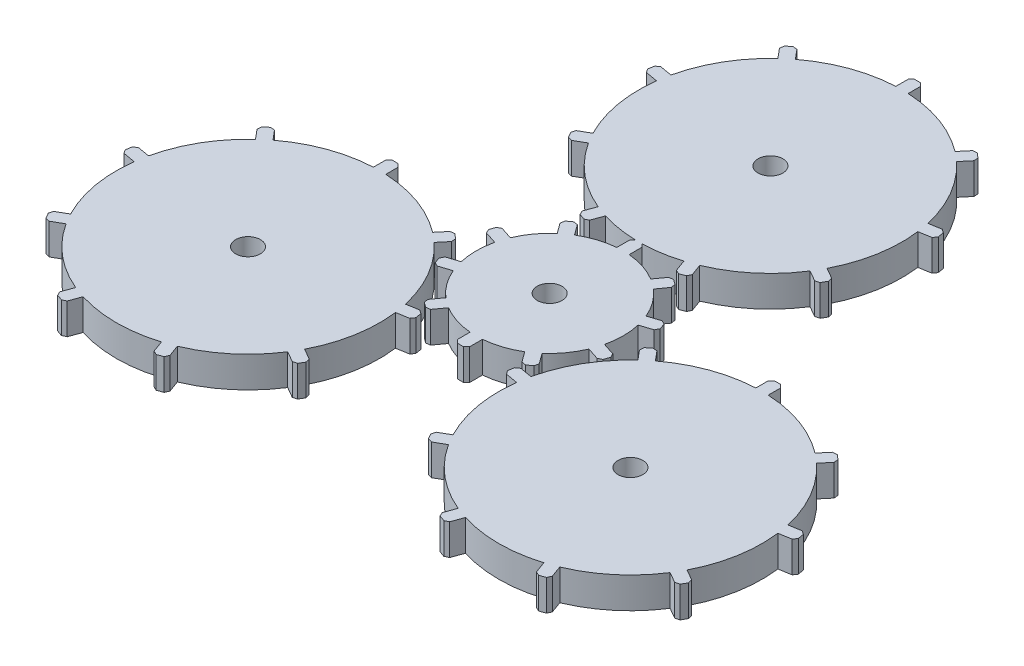
from build123d import *

# Parameters (mm, degrees)
SKETCH_1_R        = 4
EXTRUDE_1_DEPTH   = 10
EXTRUDE_1_2_DEPTH = 10
EXTRUDE_1_3_DEPTH = 10


with BuildPart() as part:
    # 草圖1 → 填料-伸長1 (new body)
    with BuildSketch(Plane(origin=(0, 0, 0), x_dir=(1, 0, 0), z_dir=(0, 1, 0))):
        with BuildLine():
            Line((1, 118.707876059), (-1, 118.707876059))
            Line((-1, 118.707876059), (-2, 117.707876059))
            Line((-2, 117.707876059), (-2, 113.702915094))
            ThreePointArc((-2, 113.702915094), (-14.535856091, 111.186936383), (-25.756118931, 105.056394922))
            Line((-25.756118931, 105.056394922), (-28.330458217, 108.124373013))
            Line((-28.330458217, 108.124373013), (-29.739290269, 108.247629847))
            Line((-29.739290269, 108.247629847), (-31.271379156, 106.962054627))
            Line((-31.271379156, 106.962054627), (-31.394635989, 105.553222574))
            Line((-31.394635989, 105.553222574), (-28.820296704, 102.485244483))
            ThreePointArc((-28.820296704, 102.485244483), (-36.806079661, 92.5), (-41.460663567, 80.591486849))
            Line((-41.460663567, 80.591486849), (-45.404780176, 81.286941022))
            Line((-45.404780176, 81.286941022), (-46.563236106, 80.475781447))
            Line((-46.563236106, 80.475781447), (-46.910532462, 78.506165941))
            Line((-46.910532462, 78.506165941), (-46.099372886, 77.34771001))
            Line((-46.099372886, 77.34771001), (-42.155256278, 76.652255837))
            ThreePointArc((-42.155256278, 76.652255837), (-41.854329503, 63.869952449), (-37.765302936, 51.75559326))
            Line((-37.765302936, 51.75559326), (-41.233700873, 49.753112778))
            Line((-41.233700873, 49.753112778), (-41.599726276, 48.387087374))
            Line((-41.599726276, 48.387087374), (-40.599726276, 46.655036567))
            Line((-40.599726276, 46.655036567), (-39.233700873, 46.289011163))
            Line((-39.233700873, 46.289011163), (-35.765302936, 48.291491645))
            ThreePointArc((-35.765302936, 48.291491645), (-27.318473412, 38.693111167), (-16.399137347, 32.041349242))
            Line((-16.399137347, 32.041349242), (-17.76891467, 28.277916977))
            Line((-17.76891467, 28.277916977), (-17.171242192, 26.996204213))
            Line((-17.171242192, 26.996204213), (-15.291856951, 26.312163926))
            Line((-15.291856951, 26.312163926), (-14.010144187, 26.909836404))
            Line((-14.010144187, 26.909836404), (-12.640366864, 30.673268668))
            ThreePointArc((-12.640366864, 30.673268668), (-6.903848021, 29.314491389), (-1.034492743, 28.762592162))
            Line((-1.034492743, 28.762592162), (-2, 27.797084906))
            Line((-2, 27.797084906), (-2, 23.665639649))
            ThreePointArc((-2, 23.665639649), (-7.339153616, 22.587592262), (-12.292279983, 20.321475163))
            Line((-12.292279983, 20.321475163), (-14.720682576, 23.663884587))
            Line((-14.720682576, 23.663884587), (-16.117484822, 23.885116329))
            Line((-16.117484822, 23.885116329), (-17.735518811, 22.709545825))
            Line((-17.735518811, 22.709545825), (-17.956750553, 21.312743578))
            Line((-17.956750553, 21.312743578), (-15.528347961, 17.970334154))
            ThreePointArc((-15.528347961, 17.970334154), (-19.214153616, 13.959899742), (-21.889326812, 9.215197867))
            Line((-21.889326812, 9.215197867), (-25.818564745, 10.491884663))
            Line((-25.818564745, 10.491884663), (-27.078638256, 9.849845141))
            Line((-27.078638256, 9.849845141), (-27.696672244, 7.947732108))
            Line((-27.696672244, 7.947732108), (-27.054632722, 6.687658597))
            Line((-27.054632722, 6.687658597), (-23.125394789, 5.410971802))
            ThreePointArc((-23.125394789, 5.410971802), (-23.75, 0), (-23.125394789, -5.410971802))
            Line((-23.125394789, -5.410971802), (-27.054632722, -6.687658597))
            Line((-27.054632722, -6.687658597), (-27.696672244, -7.947732108))
            Line((-27.696672244, -7.947732108), (-27.078638256, -9.849845141))
            Line((-27.078638256, -9.849845141), (-25.818564745, -10.491884663))
            Line((-25.818564745, -10.491884663), (-21.889326812, -9.215197867))
            ThreePointArc((-21.889326812, -9.215197867), (-19.214153616, -13.959899742), (-15.528347961, -17.970334154))
            Line((-15.528347961, -17.970334154), (-17.956750553, -21.312743578))
            Line((-17.956750553, -21.312743578), (-17.735518811, -22.709545825))
            Line((-17.735518811, -22.709545825), (-16.117484822, -23.885116329))
            Line((-16.117484822, -23.885116329), (-14.720682576, -23.663884587))
            Line((-14.720682576, -23.663884587), (-12.292279983, -20.321475163))
            ThreePointArc((-12.292279983, -20.321475163), (-7.339153616, -22.587592262), (-2, -23.665639649))
            Line((-2, -23.665639649), (-2, -27.797084906))
            Line((-2, -27.797084906), (-1, -28.797084906))
            Line((-1, -28.797084906), (1, -28.797084906))
            Line((1, -28.797084906), (2, -27.797084906))
            Line((2, -27.797084906), (2, -23.665639649))
            ThreePointArc((2, -23.665639649), (7.339153616, -22.587592262), (12.292279983, -20.321475163))
            Line((12.292279983, -20.321475163), (14.720682576, -23.663884587))
            Line((14.720682576, -23.663884587), (16.117484822, -23.885116329))
            Line((16.117484822, -23.885116329), (17.735518811, -22.709545825))
            Line((17.735518811, -22.709545825), (17.956750553, -21.312743578))
            Line((17.956750553, -21.312743578), (15.528347961, -17.970334154))
            ThreePointArc((15.528347961, -17.970334154), (19.214153616, -13.959899742), (21.889326812, -9.215197867))
            Line((21.889326812, -9.215197867), (25.818564745, -10.491884663))
            Line((25.818564745, -10.491884663), (27.078638256, -9.849845141))
            Line((27.078638256, -9.849845141), (27.696672244, -7.947732108))
            Line((27.696672244, -7.947732108), (27.054632722, -6.687658597))
            Line((27.054632722, -6.687658597), (23.125394789, -5.410971802))
            ThreePointArc((23.125394789, -5.410971802), (23.75, 0), (23.125394789, 5.410971802))
            Line((23.125394789, 5.410971802), (27.054632722, 6.687658597))
            Line((27.054632722, 6.687658597), (27.696672244, 7.947732108))
            Line((27.696672244, 7.947732108), (27.078638256, 9.849845141))
            Line((27.078638256, 9.849845141), (25.818564745, 10.491884663))
            Line((25.818564745, 10.491884663), (21.889326812, 9.215197867))
            ThreePointArc((21.889326812, 9.215197867), (19.214153616, 13.959899742), (15.528347961, 17.970334154))
            Line((15.528347961, 17.970334154), (17.956750553, 21.312743578))
            Line((17.956750553, 21.312743578), (17.735518811, 22.709545825))
            Line((17.735518811, 22.709545825), (16.117484822, 23.885116329))
            Line((16.117484822, 23.885116329), (14.720682576, 23.663884587))
            Line((14.720682576, 23.663884587), (12.292279983, 20.321475163))
            ThreePointArc((12.292279983, 20.321475163), (7.339153616, 22.587592262), (2, 23.665639649))
            Line((2, 23.665639649), (2, 27.797084906))
            Line((2, 27.797084906), (1.034492743, 28.762592162))
            ThreePointArc((1.034492743, 28.762592162), (6.903848021, 29.314491389), (12.640366864, 30.673268668))
            Line((12.640366864, 30.673268668), (14.010144187, 26.909836404))
            Line((14.010144187, 26.909836404), (15.291856951, 26.312163926))
            Line((15.291856951, 26.312163926), (17.171242192, 26.996204213))
            Line((17.171242192, 26.996204213), (17.76891467, 28.277916977))
            Line((17.76891467, 28.277916977), (16.399137347, 32.041349242))
            ThreePointArc((16.399137347, 32.041349242), (27.318473412, 38.693111167), (35.765302936, 48.291491645))
            Line((35.765302936, 48.291491645), (39.233700873, 46.289011163))
            Line((39.233700873, 46.289011163), (40.599726276, 46.655036567))
            Line((40.599726276, 46.655036567), (41.599726276, 48.387087374))
            Line((41.599726276, 48.387087374), (41.233700873, 49.753112778))
            Line((41.233700873, 49.753112778), (37.765302936, 51.75559326))
            ThreePointArc((37.765302936, 51.75559326), (41.854329503, 63.869952449), (42.155256278, 76.652255837))
            Line((42.155256278, 76.652255837), (46.099372886, 77.34771001))
            Line((46.099372886, 77.34771001), (46.910532462, 78.506165941))
            Line((46.910532462, 78.506165941), (46.563236106, 80.475781447))
            Line((46.563236106, 80.475781447), (45.404780176, 81.286941022))
            Line((45.404780176, 81.286941022), (41.460663567, 80.591486849))
            ThreePointArc((41.460663567, 80.591486849), (36.806079661, 92.5), (28.820296704, 102.485244483))
            Line((28.820296704, 102.485244483), (31.394635989, 105.553222574))
            Line((31.394635989, 105.553222574), (31.271379156, 106.962054627))
            Line((31.271379156, 106.962054627), (29.739290269, 108.247629847))
            Line((29.739290269, 108.247629847), (28.330458217, 108.124373013))
            Line((28.330458217, 108.124373013), (25.756118931, 105.056394922))
            ThreePointArc((25.756118931, 105.056394922), (14.535856091, 111.186936383), (2, 113.702915094))
            Line((2, 113.702915094), (2, 117.707876059))
            Line((2, 117.707876059), (1, 118.707876059))
        make_face()
        with Locations(Location((0, 71.25, 0), (0, 0, 270))):
            Circle(SKETCH_1_R, mode=Mode.SUBTRACT)
        with Locations(Location((0, 0, 0), (0, 0, 270))):
            Circle(SKETCH_1_R, mode=Mode.SUBTRACT)
    extrude(amount=EXTRUDE_1_DEPTH)


with BuildPart() as body_2:
    # 草圖1 → Extrude 1 2 (new body)
    with BuildSketch(Plane(origin=(0, 0, 0), x_dir=(1, 0, 0), z_dir=(0, 1, 0))):
        with BuildLine():
            Line((-20.470609147, -57.121887222), (-23.939007083, -55.11940674))
            ThreePointArc((-23.939007083, -55.11940674), (-19.849980517, -43.005047551), (-19.549053742, -30.222744163))
            Line((-19.549053742, -30.222744163), (-15.604937133, -29.52728999))
            Line((-15.604937133, -29.52728999), (-14.793777558, -28.368834059))
            Line((-14.793777558, -28.368834059), (-15.141073913, -26.399218553))
            Line((-15.141073913, -26.399218553), (-16.299529844, -25.588058978))
            Line((-16.299529844, -25.588058978), (-20.243646452, -26.283513151))
            ThreePointArc((-20.243646452, -26.283513151), (-24.898230359, -14.375), (-32.884013316, -4.389755517))
            Line((-32.884013316, -4.389755517), (-30.309674031, -1.321777426))
            Line((-30.309674031, -1.321777426), (-30.432930864, 0.087054627))
            Line((-30.432930864, 0.087054627), (-31.96501975, 1.372629847))
            Line((-31.96501975, 1.372629847), (-33.373851803, 1.249373013))
            Line((-33.373851803, 1.249373013), (-35.948191088, -1.818605078))
            ThreePointArc((-35.948191088, -1.818605078), (-47.168453928, 4.311936383), (-59.70431002, 6.827915094))
            Line((-59.70431002, 6.827915094), (-59.70431002, 10.832876059))
            Line((-59.70431002, 10.832876059), (-60.70431002, 11.832876059))
            Line((-60.70431002, 11.832876059), (-62.70431002, 11.832876059))
            Line((-62.70431002, 11.832876059), (-63.70431002, 10.832876059))
            Line((-63.70431002, 10.832876059), (-63.70431002, 6.827915094))
            ThreePointArc((-63.70431002, 6.827915094), (-76.240166111, 4.311936383), (-87.460428951, -1.818605078))
            Line((-87.460428951, -1.818605078), (-90.034768236, 1.249373013))
            Line((-90.034768236, 1.249373013), (-91.443600289, 1.372629847))
            Line((-91.443600289, 1.372629847), (-92.975689175, 0.087054627))
            Line((-92.975689175, 0.087054627), (-93.098946009, -1.321777426))
            Line((-93.098946009, -1.321777426), (-90.524606724, -4.389755517))
            ThreePointArc((-90.524606724, -4.389755517), (-98.51038968, -14.375), (-103.164973587, -26.283513151))
            Line((-103.164973587, -26.283513151), (-107.109090195, -25.588058978))
            Line((-107.109090195, -25.588058978), (-108.267546126, -26.399218553))
            Line((-108.267546126, -26.399218553), (-108.614842481, -28.368834059))
            Line((-108.614842481, -28.368834059), (-107.803682906, -29.52728999))
            Line((-107.803682906, -29.52728999), (-103.859566298, -30.222744163))
            ThreePointArc((-103.859566298, -30.222744163), (-103.558639523, -43.005047551), (-99.469612956, -55.11940674))
            Line((-99.469612956, -55.11940674), (-102.938010892, -57.121887222))
            Line((-102.938010892, -57.121887222), (-103.304036296, -58.487912626))
            Line((-103.304036296, -58.487912626), (-102.304036296, -60.219963433))
            Line((-102.304036296, -60.219963433), (-100.938010892, -60.585988837))
            Line((-100.938010892, -60.585988837), (-97.469612956, -58.583508355))
            ThreePointArc((-97.469612956, -58.583508355), (-89.022783431, -68.181888833), (-78.103447366, -74.833650758))
            Line((-78.103447366, -74.833650758), (-79.473224689, -78.597083023))
            Line((-79.473224689, -78.597083023), (-78.875552212, -79.878795787))
            Line((-78.875552212, -79.878795787), (-76.99616697, -80.562836074))
            Line((-76.99616697, -80.562836074), (-75.714454206, -79.965163596))
            Line((-75.714454206, -79.965163596), (-74.344676883, -76.201731332))
            ThreePointArc((-74.344676883, -76.201731332), (-61.70431002, -78.125), (-49.063943156, -76.201731332))
            Line((-49.063943156, -76.201731332), (-47.694165833, -79.965163596))
            Line((-47.694165833, -79.965163596), (-46.412453069, -80.562836074))
            Line((-46.412453069, -80.562836074), (-44.533067827, -79.878795787))
            Line((-44.533067827, -79.878795787), (-43.93539535, -78.597083023))
            Line((-43.93539535, -78.597083023), (-45.305172673, -74.833650758))
            ThreePointArc((-45.305172673, -74.833650758), (-34.385836608, -68.181888833), (-25.939007083, -58.583508355))
            Line((-25.939007083, -58.583508355), (-22.470609147, -60.585988837))
            Line((-22.470609147, -60.585988837), (-21.104583743, -60.219963433))
            Line((-21.104583743, -60.219963433), (-20.104583743, -58.487912626))
            Line((-20.104583743, -58.487912626), (-20.470609147, -57.121887222))
        make_face()
        with Locations(Location((-61.70431002, -35.625, 0), (0, 0, 270))):
            Circle(SKETCH_1_R, mode=Mode.SUBTRACT)
    extrude(amount=EXTRUDE_1_2_DEPTH)


with BuildPart() as body_3:
    # 草圖1 → Extrude 1 3 (new body)
    with BuildSketch(Plane(origin=(0, 0, 0), x_dir=(1, 0, 0), z_dir=(0, 1, 0))):
        with BuildLine():
            Line((59.70431002, 10.832876059), (59.70431002, 6.827915094))
            ThreePointArc((59.70431002, 6.827915094), (47.168453928, 4.311936383), (35.948191088, -1.818605078))
            Line((35.948191088, -1.818605078), (33.373851803, 1.249373013))
            Line((33.373851803, 1.249373013), (31.96501975, 1.372629847))
            Line((31.96501975, 1.372629847), (30.432930864, 0.087054627))
            Line((30.432930864, 0.087054627), (30.309674031, -1.321777426))
            Line((30.309674031, -1.321777426), (32.884013316, -4.389755517))
            ThreePointArc((32.884013316, -4.389755517), (24.898230359, -14.375), (20.243646452, -26.283513151))
            Line((20.243646452, -26.283513151), (16.299529844, -25.588058978))
            Line((16.299529844, -25.588058978), (15.141073913, -26.399218553))
            Line((15.141073913, -26.399218553), (14.793777558, -28.368834059))
            Line((14.793777558, -28.368834059), (15.604937133, -29.52728999))
            Line((15.604937133, -29.52728999), (19.549053742, -30.222744163))
            ThreePointArc((19.549053742, -30.222744163), (19.849980517, -43.005047551), (23.939007083, -55.11940674))
            Line((23.939007083, -55.11940674), (20.470609147, -57.121887222))
            Line((20.470609147, -57.121887222), (20.104583743, -58.487912626))
            Line((20.104583743, -58.487912626), (21.104583743, -60.219963433))
            Line((21.104583743, -60.219963433), (22.470609147, -60.585988837))
            Line((22.470609147, -60.585988837), (25.939007083, -58.583508355))
            ThreePointArc((25.939007083, -58.583508355), (34.385836608, -68.181888833), (45.305172673, -74.833650758))
            Line((45.305172673, -74.833650758), (43.93539535, -78.597083023))
            Line((43.93539535, -78.597083023), (44.533067827, -79.878795787))
            Line((44.533067827, -79.878795787), (46.412453069, -80.562836074))
            Line((46.412453069, -80.562836074), (47.694165833, -79.965163596))
            Line((47.694165833, -79.965163596), (49.063943156, -76.201731332))
            ThreePointArc((49.063943156, -76.201731332), (61.70431002, -78.125), (74.344676883, -76.201731332))
            Line((74.344676883, -76.201731332), (75.714454206, -79.965163596))
            Line((75.714454206, -79.965163596), (76.99616697, -80.562836074))
            Line((76.99616697, -80.562836074), (78.875552212, -79.878795787))
            Line((78.875552212, -79.878795787), (79.473224689, -78.597083023))
            Line((79.473224689, -78.597083023), (78.103447366, -74.833650758))
            ThreePointArc((78.103447366, -74.833650758), (89.022783431, -68.181888833), (97.469612956, -58.583508355))
            Line((97.469612956, -58.583508355), (100.938010892, -60.585988837))
            Line((100.938010892, -60.585988837), (102.304036296, -60.219963433))
            Line((102.304036296, -60.219963433), (103.304036296, -58.487912626))
            Line((103.304036296, -58.487912626), (102.938010892, -57.121887222))
            Line((102.938010892, -57.121887222), (99.469612956, -55.11940674))
            ThreePointArc((99.469612956, -55.11940674), (103.558639523, -43.005047551), (103.859566298, -30.222744163))
            Line((103.859566298, -30.222744163), (107.803682906, -29.52728999))
            Line((107.803682906, -29.52728999), (108.614842481, -28.368834059))
            Line((108.614842481, -28.368834059), (108.267546126, -26.399218553))
            Line((108.267546126, -26.399218553), (107.109090195, -25.588058978))
            Line((107.109090195, -25.588058978), (103.164973587, -26.283513151))
            ThreePointArc((103.164973587, -26.283513151), (98.51038968, -14.375), (90.524606724, -4.389755517))
            Line((90.524606724, -4.389755517), (93.098946009, -1.321777426))
            Line((93.098946009, -1.321777426), (92.975689175, 0.087054627))
            Line((92.975689175, 0.087054627), (91.443600289, 1.372629847))
            Line((91.443600289, 1.372629847), (90.034768236, 1.249373013))
            Line((90.034768236, 1.249373013), (87.460428951, -1.818605078))
            ThreePointArc((87.460428951, -1.818605078), (76.240166111, 4.311936383), (63.70431002, 6.827915094))
            Line((63.70431002, 6.827915094), (63.70431002, 10.832876059))
            Line((63.70431002, 10.832876059), (62.70431002, 11.832876059))
            Line((62.70431002, 11.832876059), (60.70431002, 11.832876059))
            Line((60.70431002, 11.832876059), (59.70431002, 10.832876059))
        make_face()
        with Locations(Location((61.70431002, -35.625, 0), (0, 0, 270))):
            Circle(SKETCH_1_R, mode=Mode.SUBTRACT)
    extrude(amount=EXTRUDE_1_3_DEPTH)


solid = Compound([part.part, body_2.part, body_3.part])
